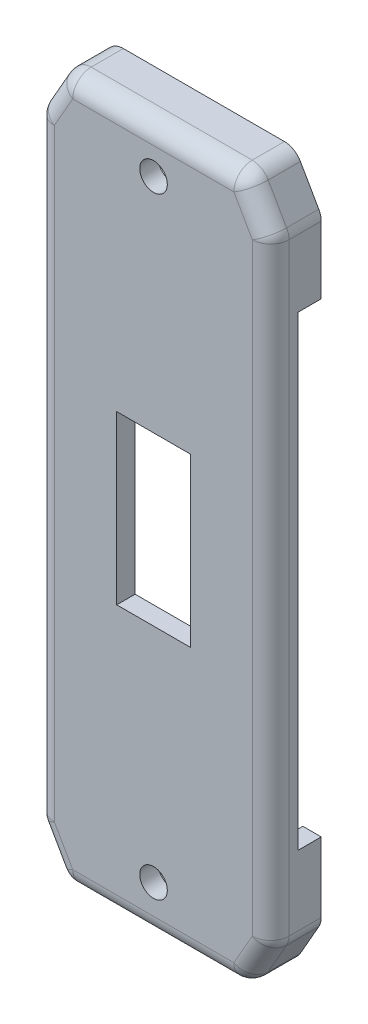
from build123d import *

# Parameters (mm, degrees)
BOSS_EXTRUDE1_DEPTH = 4.445
SKETCH2_R           = 1.905
SKETCH2_W           = 10.16
SKETCH2_H           = 23.114
BOSS_EXTRUDE2_DEPTH = 2.54
FILLET1_R           = 2.54
SKETCH3_W           = 6.4008
SKETCH3_H           = 64.3636
CUT_EXTRUDE1_DEPTH  = 2.54


with BuildPart() as part:
    # Sketch1 → Boss-Extrude1 (new body)
    with BuildSketch(Plane.XY):
        Polygon((-16.23695, 42.153431645), (-12.63096924, 48.463897975), (12.57381924, 48.463897975), (16.1798, 42.153431645), (16.1798, -42.507635695), (12.57381924, -48.818102025), (-12.63096924, -48.818102025), (-16.23695, -42.507635695), align=None)
        Polygon((-13.69695, 41.478897975), (-11.15695, 45.923897975), (11.0998, 45.923897975), (13.6398, 41.478897975), (13.6398, -41.833102025), (11.0998, -46.278102025), (-11.15695, -46.278102025), (-13.69695, -41.833102025), align=None, mode=Mode.SUBTRACT)
    extrude(amount=BOSS_EXTRUDE1_DEPTH)

    # Sketch2 → Boss-Extrude2 (add)
    with BuildSketch(Plane.XY.offset(4.445)):
        Polygon((-16.23695, 42.153431645), (-16.23695, -42.507635695), (-12.63096924, -48.818102025), (12.57381924, -48.818102025), (16.1798, -42.507635695), (16.1798, 42.153431645), (12.57381924, 48.463897975), (-12.63096924, 48.463897975), align=None)
        with Locations((0, 42.2275)):
            Circle(SKETCH2_R, mode=Mode.SUBTRACT)
        with Locations((0, -42.2275)):
            Circle(SKETCH2_R, mode=Mode.SUBTRACT)
        Rectangle(SKETCH2_W, SKETCH2_H, mode=Mode.SUBTRACT)
    extrude(amount=BOSS_EXTRUDE2_DEPTH)

    # Fillet1
    fillet1_edges = [part.edges().sort_by_distance(p)[0] for p in [
        (-16.23695, 42.153431645, 3.4925),
        (-12.63096924, 48.463897975, 3.4925),
        (12.57381924, 48.463897975, 3.4925),
        (16.1798, 42.153431645, 3.4925),
        (16.1798, -42.507635695, 3.4925),
        (12.57381924, -48.818102025, 3.4925),
        (-12.63096924, -48.818102025, 3.4925),
        (-16.23695, -42.507635695, 3.4925),
        (-14.43395962, 45.30866481, 6.985),
        (-16.23695, -0.177102025, 6.985),
        (-14.43395962, -45.66286886, 6.985),
        (-0.028575, -48.818102025, 6.985),
        (14.37680962, -45.66286886, 6.985),
        (16.1798, -0.177102025, 6.985),
        (14.37680962, 45.30866481, 6.985),
        (-0.028575, 48.463897975, 6.985),
    ]]
    fillet(fillet1_edges, radius=FILLET1_R)

    # Sketch3 → Cut-Extrude1 (cut)
    with BuildSketch(Plane(origin=(16.1798, 0, 0), x_dir=(0, 0, -1), z_dir=(1, 0, 0))):
        Rectangle(SKETCH3_W, SKETCH3_H)
    extrude(amount=-CUT_EXTRUDE1_DEPTH, mode=Mode.SUBTRACT)


solid = part.part
